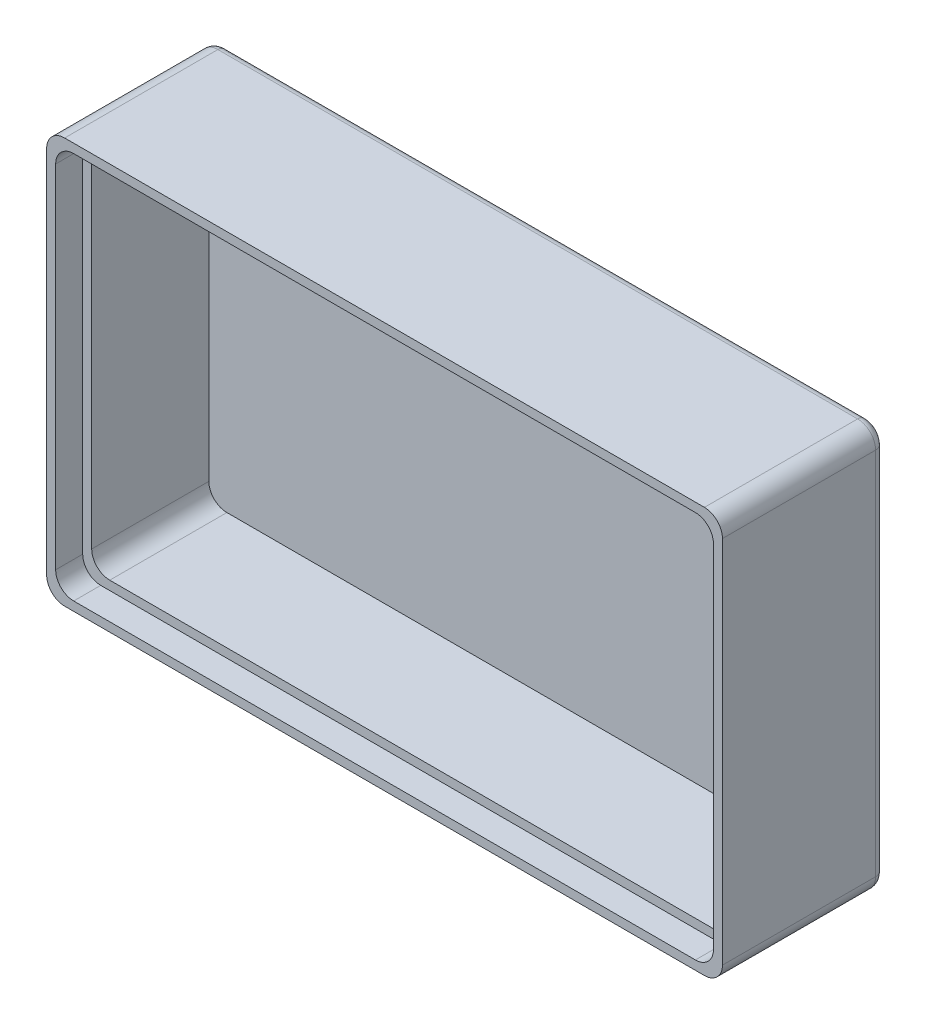
from build123d import *

# Parameters (mm, degrees)
SKETCH_1_W          = 75
SKETCH_1_H          = 45
EXTRUDE_1_DEPTH     = 18
SKETCH_2_W          = 71
SKETCH_2_H          = 41
CUT_EXTRUDE_1_DEPTH = 16
SKETCH_3_W          = 73
SKETCH_3_H          = 43
SKETCH_3_W_2        = 71
SKETCH_3_H_2        = 41
CUT_EXTRUDE_2_DEPTH = 3
FILLET_1_R          = 2
FILLET_2_R          = 1


with BuildPart() as part:
    # 草图1 → 凸台-拉伸1 (new body)
    with BuildSketch(Plane.XY):
        Rectangle(SKETCH_1_W, SKETCH_1_H)
    extrude(amount=EXTRUDE_1_DEPTH)

    # 草图2 → 切除-拉伸1 (cut)
    with BuildSketch(Plane.XY.offset(18)):
        Rectangle(SKETCH_2_W, SKETCH_2_H)
    extrude(amount=-CUT_EXTRUDE_1_DEPTH, mode=Mode.SUBTRACT)

    # 草图3 → 切除-拉伸2 (cut)
    with BuildSketch(Plane.XY.offset(18)):
        Rectangle(SKETCH_3_W, SKETCH_3_H)
        Rectangle(SKETCH_3_W_2, SKETCH_3_H_2, mode=Mode.SUBTRACT)
    extrude(amount=-CUT_EXTRUDE_2_DEPTH, mode=Mode.SUBTRACT)

    # 圆角1
    fillet_1_edges = [part.edges().sort_by_distance(p)[0] for p in [
        (-35.5, 20.5, 8.5),
        (35.5, 20.5, 8.5),
        (35.5, -20.5, 8.5),
        (-35.5, -20.5, 8.5),
        (-36.5, -21.5, 16.5),
        (-36.5, 21.5, 16.5),
        (36.5, 21.5, 16.5),
        (36.5, -21.5, 16.5),
        (-37.5, 22.5, 9),
        (37.5, 22.5, 9),
        (37.5, -22.5, 9),
        (-37.5, -22.5, 9),
    ]]
    fillet(fillet_1_edges, radius=FILLET_1_R)

    # 圆角2
    fillet_2_edges = [part.edges().sort_by_distance(p)[0] for p in [
        (0, -22.5, 0),
        (-37.5, 0, 0),
        (0, 22.5, 0),
        (37.5, 0, 0),
        (-36.914213562, 21.914213562, 0),
        (36.914213562, 21.914213562, 0),
        (36.914213562, -21.914213562, 0),
        (-36.914213562, -21.914213562, 0),
    ]]
    fillet(fillet_2_edges, radius=FILLET_2_R)


solid = part.part
